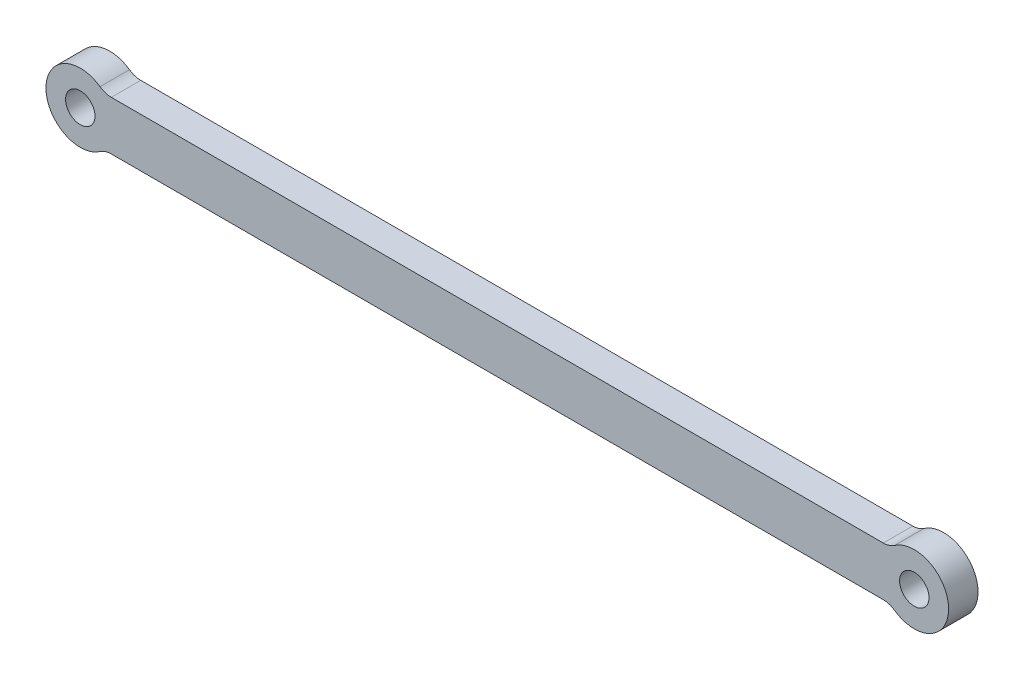
from build123d import *
from build123d.topology import SkipClean

# Parameters (mm, degrees)
SKETCH_1_R          = 1.5
EXTRUDE_1_DEPTH     = 3
CUT_EXTRUDE_1_DEPTH = 89.619975175


with BuildPart() as part:
    # 草图1 → 凸台-拉伸1 (new body)
    with BuildSketch(Plane.XY):
        with BuildLine():
            Line((0, 3.5), (85, 3.5))
            ThreePointArc((85, 3.5), (88.5, 0), (85, -3.5))
            Line((85, -3.5), (0, -3.5))
            ThreePointArc((0, -3.5), (-3.5, 0), (0, 3.5))
        make_face()
        Circle(SKETCH_1_R, mode=Mode.SUBTRACT)
        with Locations((85, 0)):
            Circle(SKETCH_1_R, mode=Mode.SUBTRACT)
    extrude(amount=EXTRUDE_1_DEPTH)

    # 草图2 → 切除-拉伸1 (cut, through all)
    with SkipClean():  # the faces are left unmerged after this step: merging them gives an invalid solid
        with BuildSketch(Plane.XY.offset(3)):
            with BuildLine():
                Line((3.16227766, 2.5), (81.83772234, 2.5))
                ThreePointArc((81.83772234, 2.5), (82.440745029, 2.593074822), (82.987641489, 2.863636364))
                ThreePointArc((82.987641489, 2.863636364), (83.944710294, 3.337119062), (85, 3.5))
                Line((85, 3.5), (0, 3.5))
                ThreePointArc((0, 3.5), (1.055289706, 3.337119062), (2.012358511, 2.863636364))
                ThreePointArc((2.012358511, 2.863636364), (2.559254971, 2.593074822), (3.16227766, 2.5))
            make_face()
            with BuildLine():
                Line((3.16227766, -2.5), (81.83772234, -2.5))
                ThreePointArc((81.83772234, -2.5), (82.440745029, -2.593074822), (82.987641489, -2.863636364))
                ThreePointArc((82.987641489, -2.863636364), (83.944710294, -3.337119062), (85, -3.5))
                Line((85, -3.5), (0, -3.5))
                ThreePointArc((0, -3.5), (1.055289706, -3.337119062), (2.012358511, -2.863636364))
                ThreePointArc((2.012358511, -2.863636364), (2.559254971, -2.593074822), (3.16227766, -2.5))
            make_face()
        extrude(amount=-CUT_EXTRUDE_1_DEPTH, mode=Mode.SUBTRACT)


solid = part.part
